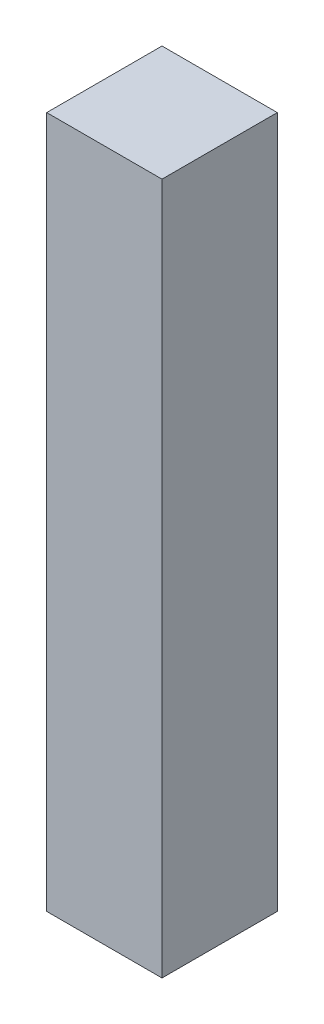
from build123d import *

# Parameters (mm, degrees)
SKETCH1_W           = 5
SKETCH1_H           = 5
BOSS_EXTRUDE1_DEPTH = 15


with BuildPart() as part:
    # Sketch1 → Boss-Extrude1 (new, symmetric)
    with BuildSketch(Plane(origin=(0, 0, 0), x_dir=(1, 0, 0), z_dir=(0, 1, 0))):
        Rectangle(SKETCH1_W, SKETCH1_H)
    extrude(amount=BOSS_EXTRUDE1_DEPTH, both=True)


solid = part.part
